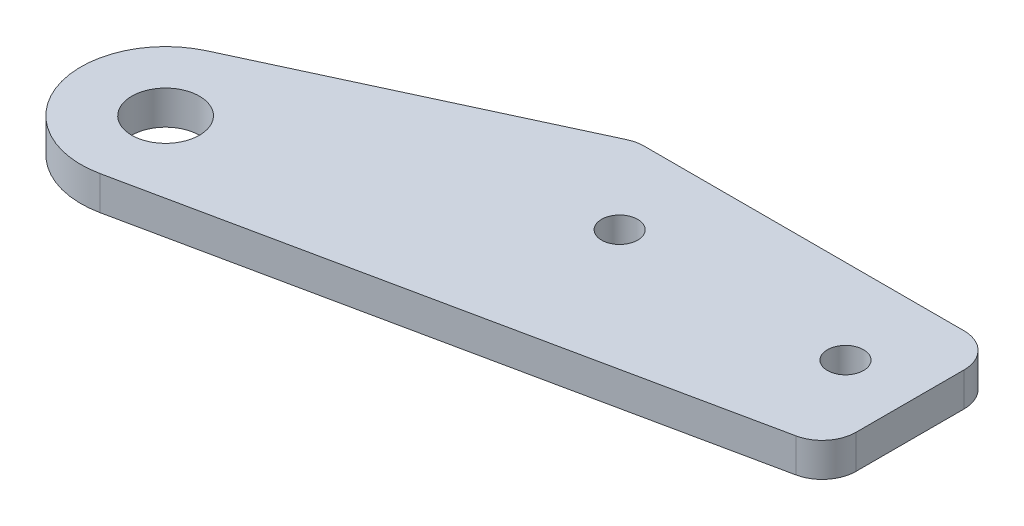
from build123d import *

# Parameters (mm, degrees)
SKETCH_1_R      = 7.5
SKETCH_1_R_2    = 3
SKETCH_1_W      = 32
SKETCH_1_H      = 15
SKETCH_1_R_3    = 1.6
EXTRUDE_1_DEPTH = 3
FILLET_1_R      = 3


with BuildPart() as part:
    # 草图1 → 凸台-拉伸1 (new body)
    # profile 1 of 3: a face of its own
    with BuildSketch(Plane(origin=(0, 0, 0), x_dir=(1, 0, 0), z_dir=(0, 1, 0))):
        with Locations((-22.85, -3.86)):
            Circle(SKETCH_1_R)
        with Locations(Location((-22.85, -3.86, 0), (0, 0, 270))):
            Circle(SKETCH_1_R_2, mode=Mode.SUBTRACT)
    # profile 2 of 3: a face of its own
    with BuildSketch(Plane(origin=(0, 0, 0), x_dir=(1, 0, 0), z_dir=(0, 1, 0))):
        with BuildLine():
            Line((0, 0), (0, 15))
            Line((0, 15), (-26.004488854, 2.944351554))
            ThreePointArc((-26.004488854, 2.944351554), (-18.813210831, 2.460944012), (-15.35, -3.86))
            ThreePointArc((-15.35, -3.86), (-17.02696903, -8.586765312), (-21.307949418, -11.199760214))
            Line((-21.307949418, -11.199760214), (32, 0))
            Line((32, 0), (0, 0))
        make_face()
    # profile 3 of 3: a face of its own
    with BuildSketch(Plane(origin=(0, 0, 0), x_dir=(1, 0, 0), z_dir=(0, 1, 0))):
        with Locations((16, 7.5)):
            Rectangle(SKETCH_1_W, SKETCH_1_H)
        with Locations(Location((26, 7.5, 0), (0, 0, 270))):
            Circle(SKETCH_1_R_3, mode=Mode.SUBTRACT)
        with Locations(Location((6, 7.5, 0), (0, 0, 270))):
            Circle(SKETCH_1_R_3, mode=Mode.SUBTRACT)
    extrude(amount=EXTRUDE_1_DEPTH)

    # 圆角1
    fillet_1_edges = [part.edges().sort_by_distance(p)[0] for p in [
        (0, 1.5, -15),
        (32, 1.5, -15),
        (32, 1.5, 0),
    ]]
    fillet(fillet_1_edges, radius=FILLET_1_R)


solid = part.part
